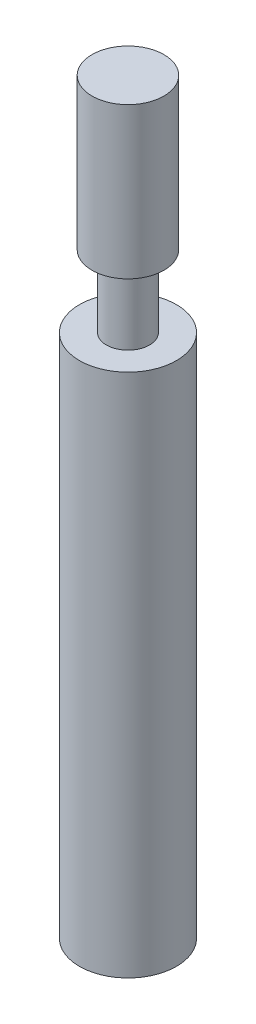
from build123d import *

# Parameters (mm, degrees)
SKETCH1_R           = 3.375
BOSS_EXTRUDE1_DEPTH = 41.5
SKETCH2_R           = 2.5
BOSS_EXTRUDE2_DEPTH = 10.5
CUT_EXTRUDE1_START  = -5
SKETCH3_R           = 3.375
SKETCH3_R_2         = 1.5
CUT_EXTRUDE1_DEPTH  = 5


with BuildPart() as part:
    # Sketch1 → Boss-Extrude1 (new body)
    with BuildSketch(Plane(origin=(0, 0, 0), x_dir=(1, 0, 0), z_dir=(0, 1, 0))):
        with Locations(Location((0, 0, 0), (0, 0, 270))):
            Circle(SKETCH1_R)
    extrude(amount=BOSS_EXTRUDE1_DEPTH)

    # Sketch2 → Boss-Extrude2 (add)
    with BuildSketch(Plane(origin=(0, 41.5, 0), x_dir=(1, 0, 0), z_dir=(0, 1, 0))):
        with Locations(Location((0, 0, 0), (0, 0, 90))):
            Circle(SKETCH2_R)
    extrude(amount=BOSS_EXTRUDE2_DEPTH)

    # Sketch3 → Cut-Extrude1 (cut)
    with BuildSketch(Plane(origin=(0, 41.5, 0), x_dir=(1, 0, 0), z_dir=(0, 1, 0)).offset(CUT_EXTRUDE1_START)):
        with Locations(Location((0, 0, 0), (0, 0, 270))):
            Circle(SKETCH3_R)
        with Locations(Location((0, 0, 0), (0, 0, 270))):
            Circle(SKETCH3_R_2, mode=Mode.SUBTRACT)
    extrude(amount=CUT_EXTRUDE1_DEPTH, mode=Mode.SUBTRACT)


solid = part.part
